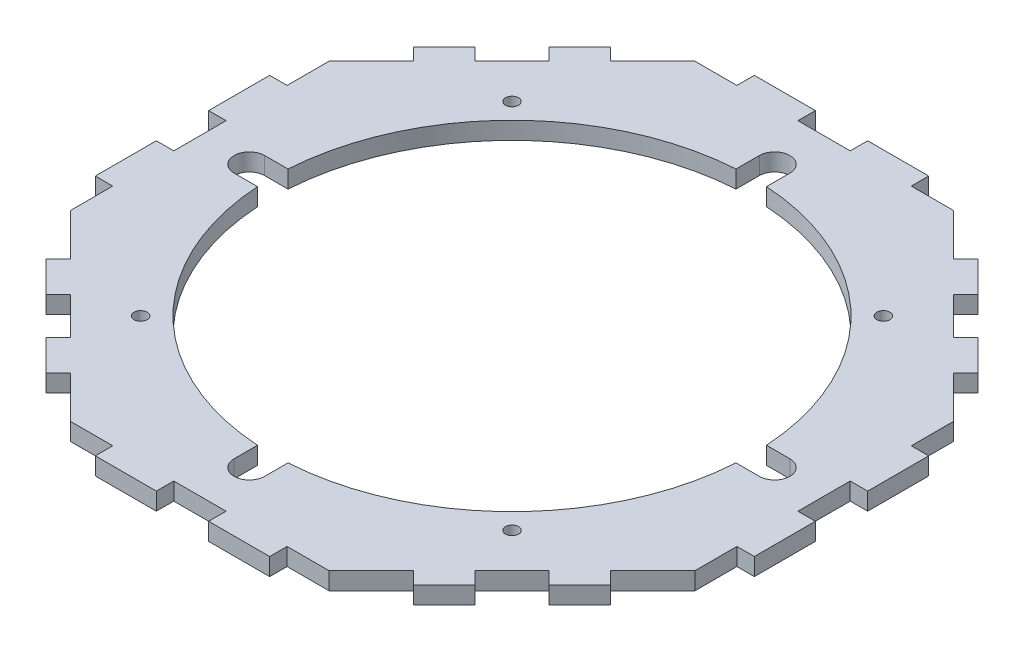
from build123d import *

# Parameters (mm, degrees)
SKETCH1_R           = 100
BOSS_EXTRUDE1_DEPTH = 4
SKETCH2_W           = 4
SKETCH2_H           = 12
SKETCH2_W_2         = 12
SKETCH2_H_2         = 4
CUT_EXTRUDE1_DEPTH  = 4
CUT_EXTRUDE3_START  = -4
SKETCH3_R           = 100
CUT_EXTRUDE3_DEPTH  = 4
SKETCH5_R           = 55
CUT_EXTRUDE4_DEPTH  = 107.986490191
SKETCH6_R           = 1.5
CUT_EXTRUDE5_DEPTH  = 107.986490191
CIRPATTERN1_COUNT   = 8
SKETCH7_R           = 3.5
CUT_EXTRUDE6_DEPTH  = 10
CIRPATTERN2_COUNT   = 4


with BuildPart() as part:
    # Sketch1 → Boss-Extrude1 (new body)
    with BuildSketch(Plane(origin=(0, 0, 0), x_dir=(1, 0, 0), z_dir=(0, 1, 0))):
        with Locations(Location((0, 0, 0), (0, 0, 270))):
            Circle(SKETCH1_R)
    extrude(amount=BOSS_EXTRUDE1_DEPTH)

    # Sketch2 → Cut-Extrude1 (cut)
    with BuildSketch(Plane(origin=(0, 4, 0), x_dir=(1, 0, 0), z_dir=(0, 1, 0))):
        with Locations((-73.597979746, -26)):
            Rectangle(SKETCH2_W, SKETCH2_H)
        with Locations((-73.597979746, 0)):
            Rectangle(SKETCH2_W, SKETCH2_H)
        with Locations((-73.597979746, 26)):
            Rectangle(SKETCH2_W, SKETCH2_H)
        Polygon((-70.426406871, 30.828427125), (-73.254833996, 33.656854249), (-64.769552622, 42.142135624), (-61.941125497, 39.313708499), align=None)
        Polygon((-54.870057685, 46.384776311), (-57.69848481, 49.213203436), (-49.213203436, 57.69848481), (-46.384776311, 54.870057685), align=None)
        Polygon((-39.313708499, 61.941125497), (-42.142135624, 64.769552622), (-33.656854249, 73.254833996), (-30.828427125, 70.426406871), align=None)
        with Locations((-26, 73.597979746)):
            Rectangle(SKETCH2_W_2, SKETCH2_H_2)
        with Locations((0, 73.597979746)):
            Rectangle(SKETCH2_W_2, SKETCH2_H_2)
        with Locations((26, 73.597979746)):
            Rectangle(SKETCH2_W_2, SKETCH2_H_2)
        Polygon((42.142135624, 64.769552622), (39.313708499, 61.941125497), (30.828427125, 70.426406871), (33.656854249, 73.254833996), align=None)
        Polygon((57.69848481, 49.213203436), (54.870057685, 46.384776311), (46.384776311, 54.870057685), (49.213203436, 57.69848481), align=None)
        Polygon((73.254833996, 33.656854249), (70.426406871, 30.828427125), (61.941125497, 39.313708499), (64.769552622, 42.142135624), align=None)
        with Locations((73.597979746, 0)):
            Rectangle(SKETCH2_W, SKETCH2_H)
        with Locations((73.597979746, 26)):
            Rectangle(SKETCH2_W, SKETCH2_H)
        with Locations((73.597979746, -26)):
            Rectangle(SKETCH2_W, SKETCH2_H)
        Polygon((64.769552622, -42.142135624), (61.941125497, -39.313708499), (70.426406871, -30.828427125), (73.254833996, -33.656854249), align=None)
        Polygon((71.597979746, -32), (71.597979746, -29.656854249), (70.426406871, -30.828427125), align=None)
        Polygon((49.213203436, -57.69848481), (46.384776311, -54.870057685), (54.870057685, -46.384776311), (57.69848481, -49.213203436), align=None)
        Polygon((33.656854249, -73.254833996), (30.828427125, -70.426406871), (39.313708499, -61.941125497), (42.142135624, -64.769552622), align=None)
        Polygon((32, -71.597979746), (30.828427125, -70.426406871), (29.656854249, -71.597979746), align=None)
        with Locations((26, -73.597979746)):
            Rectangle(SKETCH2_W_2, SKETCH2_H_2)
        with Locations((0, -73.597979746)):
            Rectangle(SKETCH2_W_2, SKETCH2_H_2)
        with Locations((-26, -73.597979746)):
            Rectangle(SKETCH2_W_2, SKETCH2_H_2)
        Polygon((-29.656854249, -71.597979746), (-30.828427125, -70.426406871), (-32, -71.597979746), align=None)
        Polygon((-30.828427125, -70.426406871), (-33.656854249, -73.254833996), (-42.142135624, -64.769552622), (-39.313708499, -61.941125497), align=None)
        Polygon((-46.384776311, -54.870057685), (-49.213203436, -57.69848481), (-57.69848481, -49.213203436), (-54.870057685, -46.384776311), align=None)
        Polygon((-61.941125497, -39.313708499), (-64.769552622, -42.142135624), (-73.254833996, -33.656854249), (-70.426406871, -30.828427125), align=None)
        Polygon((-70.426406871, -30.828427125), (-71.597979746, -29.656854249), (-71.597979746, -32), align=None)
        Polygon((-71.597979746, 29.656854249), (-70.426406871, 30.828427125), (-71.597979746, 32), align=None)
        Polygon((-29.656854249, 71.597979746), (-32, 71.597979746), (-30.828427125, 70.426406871), align=None)
        Polygon((32, 71.597979746), (29.656854249, 71.597979746), (30.828427125, 70.426406871), align=None)
        Polygon((71.597979746, 32), (70.426406871, 30.828427125), (71.597979746, 29.656854249), align=None)
    extrude(amount=-CUT_EXTRUDE1_DEPTH, mode=Mode.SUBTRACT)

    # Sketch3 → Cut-Extrude3 (cut)
    # profile 1 of 5: a face of its own
    with BuildSketch(Plane(origin=(0, 4, 0), x_dir=(1, 0, 0), z_dir=(0, 1, 0)).offset(CUT_EXTRUDE3_START)):
        Circle(SKETCH3_R)
        Polygon((75.597979746, -32), (32, -75.597979746), (-32, -75.597979746), (-75.597979746, -32), (-75.597979746, 32), (-32, 75.597979746), (32, 75.597979746), (75.597979746, 32), align=None, mode=Mode.SUBTRACT)
    # profile 2 of 5: a face of its own
    with BuildSketch(Plane(origin=(0, 4, 0), x_dir=(1, 0, 0), z_dir=(0, 1, 0)).offset(CUT_EXTRUDE3_START)):
        Polygon((-75.597979746, 32), (-75.597979746, 30.611659087), (-70.199499966, 31.905014714), (-64.769552622, 42.142135624), (-42.142135624, 64.769552622), (-31.064182622, 71.665632478), (-28.788746713, 75.597979746), (-32, 75.597979746), align=None)
    # profile 3 of 5: a face of its own
    with BuildSketch(Plane(origin=(0, 4, 0), x_dir=(1, 0, 0), z_dir=(0, 1, 0)).offset(CUT_EXTRUDE3_START)):
        Polygon((-75.597979746, -32), (-32, -75.597979746), (-29.093903597, -75.597979746), (-30.351010999, -72.169062048), (-42.142135624, -64.769552622), (-64.769552622, -42.142135624), (-71.252442115, -31.167934151), (-75.597979746, -30.54862762), align=None)
    # profile 4 of 5: a face of its own
    with BuildSketch(Plane(origin=(0, 4, 0), x_dir=(1, 0, 0), z_dir=(0, 1, 0)).offset(CUT_EXTRUDE3_START)):
        Polygon((32, -70.176952979), (27.328089277, -75.597979746), (32, -75.597979746), (75.597979746, -32), (75.597979746, -29.546495423), (70.83875298, -31.3565945), (64.769552622, -42.142135624), (42.142135624, -64.769552622), align=None)
    # profile 5 of 5: a face of its own
    with BuildSketch(Plane(origin=(0, 4, 0), x_dir=(1, 0, 0), z_dir=(0, 1, 0)).offset(CUT_EXTRUDE3_START)):
        Polygon((70.83875298, 31.531789385), (75.597979746, 29.562368083), (75.597979746, 32), (32, 75.597979746), (29.807879635, 75.597979746), (31.156089891, 71.258119345), (42.142135624, 64.769552622), (64.769552622, 42.142135624), align=None)
    extrude(amount=CUT_EXTRUDE3_DEPTH, mode=Mode.SUBTRACT)

    # Sketch5 → Cut-Extrude4 (cut, through all)
    with BuildSketch(Plane(origin=(0, 4, 0), x_dir=(1, 0, 0), z_dir=(0, 1, 0))):
        with Locations(Location((0, 0, 0), (0, 0, 270))):
            Circle(SKETCH5_R)
    extrude(amount=-CUT_EXTRUDE4_DEPTH, mode=Mode.SUBTRACT)

    # Sketch6 → Cut-Extrude5 (cut, through all)
    with BuildSketch(Plane(origin=(0, 4, 0), x_dir=(1, 0, 0), z_dir=(0, 1, 0))):
        with Locations(Location((-60.25, 0, 0), (0, 0, 270))):
            Circle(SKETCH6_R)
    cut_extrude5 = extrude(amount=-CUT_EXTRUDE5_DEPTH, mode=Mode.SUBTRACT)

    # CirPattern1: Cut-Extrude5 ×8 about axis
    cirpattern1_axis = Axis((0, 0, 0), (0, 1, 0))
    for i in range(1, CIRPATTERN1_COUNT):
        add(cut_extrude5.rotate(cirpattern1_axis, i * 360 / CIRPATTERN1_COUNT), mode=Mode.SUBTRACT)

    # Sketch7 → Cut-Extrude6 (cut)
    with BuildSketch(Plane(origin=(0, 4, 0), x_dir=(1, 0, 0), z_dir=(0, 1, 0))):
        with BuildLine():
            ThreePointArc((3.5, 60.25), (0, 56.75), (-3.5, 60.25))
            Line((-3.5, 60.25), (-3.5, 54.888523391))
            ThreePointArc((-3.5, 54.888523391), (0, 55), (3.5, 54.888523391))
            Line((3.5, 54.888523391), (3.5, 60.25))
        make_face()
        with Locations((0, 60.25)):
            Circle(SKETCH7_R)
    cut_extrude6 = extrude(amount=-CUT_EXTRUDE6_DEPTH, mode=Mode.SUBTRACT)

    # CirPattern2: Cut-Extrude6 ×4 about axis
    cirpattern2_axis = Axis((0, 0, 0), (0, 1, 0))
    for i in range(1, CIRPATTERN2_COUNT):
        add(cut_extrude6.rotate(cirpattern2_axis, i * 360 / CIRPATTERN2_COUNT), mode=Mode.SUBTRACT)


solid = part.part
